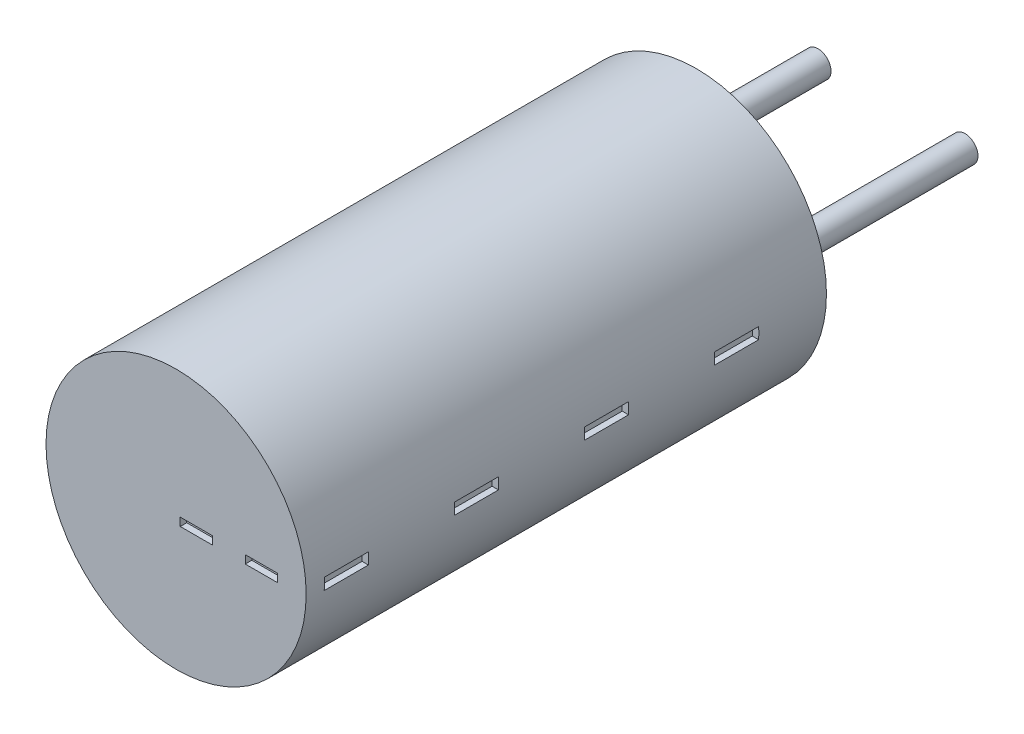
from build123d import *

# Parameters (mm, degrees)
SKETCH_1_R          = 2
EXTRUDE_1_DEPTH     = 8
SKETCH_2_R          = 0.2
EXTRUDE_2_DEPTH     = 3
SKETCH_3_W          = 0.679467602
SKETCH_3_H          = 0.176485091
CUT_EXTRUDE_1_DEPTH = 0.1
SKETCH_6_W          = 0.495308974
SKETCH_6_H          = 0.125078023
CUT_EXTRUDE_2_DEPTH = 0.1


with BuildPart() as part:
    # 草图1 → 凸台-拉伸1 (new body)
    with BuildSketch(Plane.XY):
        Circle(SKETCH_1_R)
    extrude(amount=EXTRUDE_1_DEPTH)

    # 草图2 → 凸台-拉伸2 (add)
    with BuildSketch(Plane(origin=(0, 0, 0), x_dir=(-1, 0, 0), z_dir=(0, 0, -1))):
        with Locations(Location((-1.13, 0, 0), (0, 0, 180))):
            Circle(SKETCH_2_R)
        with Locations(Location((1.13, 0, 0), (0, 0, 180))):
            Circle(SKETCH_2_R)
    extrude(amount=EXTRUDE_2_DEPTH)

    # 草图3 → 切除-拉伸1 (cut)
    with BuildSketch(Plane(origin=(2, 0, 0), x_dir=(0, 0, -1), z_dir=(1, 0, 0))):
        with Locations((-5.380383813, -0.002684697)):
            Rectangle(SKETCH_3_W, SKETCH_3_H)
        with Locations((-7.380383813, -0.002684697)):
            Rectangle(SKETCH_3_W, SKETCH_3_H)
        with Locations((-3.380383813, -0.002684697)):
            Rectangle(SKETCH_3_W, SKETCH_3_H)
        with Locations((-1.380383813, -0.002684697)):
            Rectangle(SKETCH_3_W, SKETCH_3_H)
    extrude(amount=-CUT_EXTRUDE_1_DEPTH, mode=Mode.SUBTRACT)

    # 草图6 → 切除-拉伸2 (cut)
    with BuildSketch(Plane.XY.offset(8)):
        with Locations((1.311678539, -0.002672358)):
            Rectangle(SKETCH_6_W, SKETCH_6_H)
        with Locations((0.311678539, -0.002672358)):
            Rectangle(SKETCH_6_W, SKETCH_6_H)
    extrude(amount=-CUT_EXTRUDE_2_DEPTH, mode=Mode.SUBTRACT)


solid = part.part
